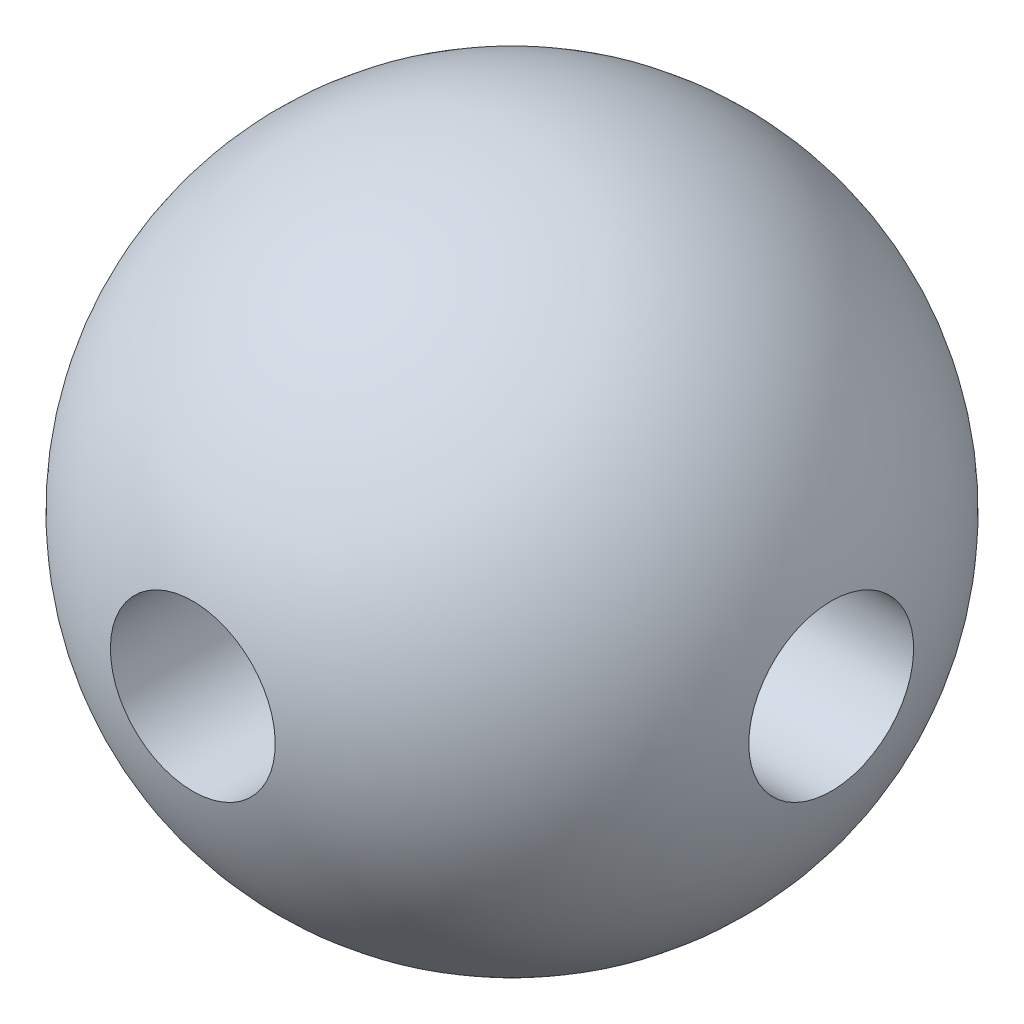
from build123d import *
from build123d.topology import SkipClean

# Parameters (mm, degrees)
CUT_EXTRUDE1_DEPTH      = 6.196152423
CUT_EXTRUDE1_DEPTH_BACK = 6.196152423
SKETCH2_R               = 0.75
CUT_EXTRUDE2_DEPTH      = 6.141741007
CUT_EXTRUDE2_DEPTH_BACK = 6.141741007
SKETCH3_R               = 0.75


with BuildPart() as part:
    # Sketch1 → Revolve1 (revolve)
    with SkipClean():  # the faces are left unmerged after this step: merging them gives an invalid solid
        with BuildSketch(Plane.XY):
            with BuildLine():
                ThreePointArc((3, 0), (2.121320344, 2.121320344), (0, 3))
                Line((0, 3), (0, -3))
                ThreePointArc((0, -3), (2.121320344, -2.121320344), (3, 0))
            make_face()
            with BuildLine():
                Line((0, -3), (0, 3))
                ThreePointArc((0, 3), (-3, 0), (0, -3))
            make_face()
        revolve(axis=Axis((0, 3, 0), (0, -1, 0)))

    # Sketch2 → Cut-Extrude1 (cut, two sides: drawn at the far end of the back side and taken through both)
    with SkipClean():  # the faces are left unmerged after this step: merging them gives an invalid solid
        with BuildSketch(Plane(origin=(0, 0, 0), x_dir=(0, 0, -1), z_dir=(1, 0, 0)).offset(-CUT_EXTRUDE1_DEPTH_BACK)):
            Circle(SKETCH2_R)
        extrude(amount=CUT_EXTRUDE1_DEPTH + CUT_EXTRUDE1_DEPTH_BACK, mode=Mode.SUBTRACT)

    # Sketch3 → Cut-Extrude2 (cut, two sides: drawn at the far end of the back side and taken through both)
    with SkipClean():  # the faces are left unmerged after this step: merging them gives an invalid solid
        with BuildSketch(Plane.XY.offset(-CUT_EXTRUDE2_DEPTH_BACK)):
            with Locations(Location((0, 0, 0), (0, 0, 270))):
                Circle(SKETCH3_R)
        extrude(amount=CUT_EXTRUDE2_DEPTH + CUT_EXTRUDE2_DEPTH_BACK, mode=Mode.SUBTRACT)


solid = part.part
